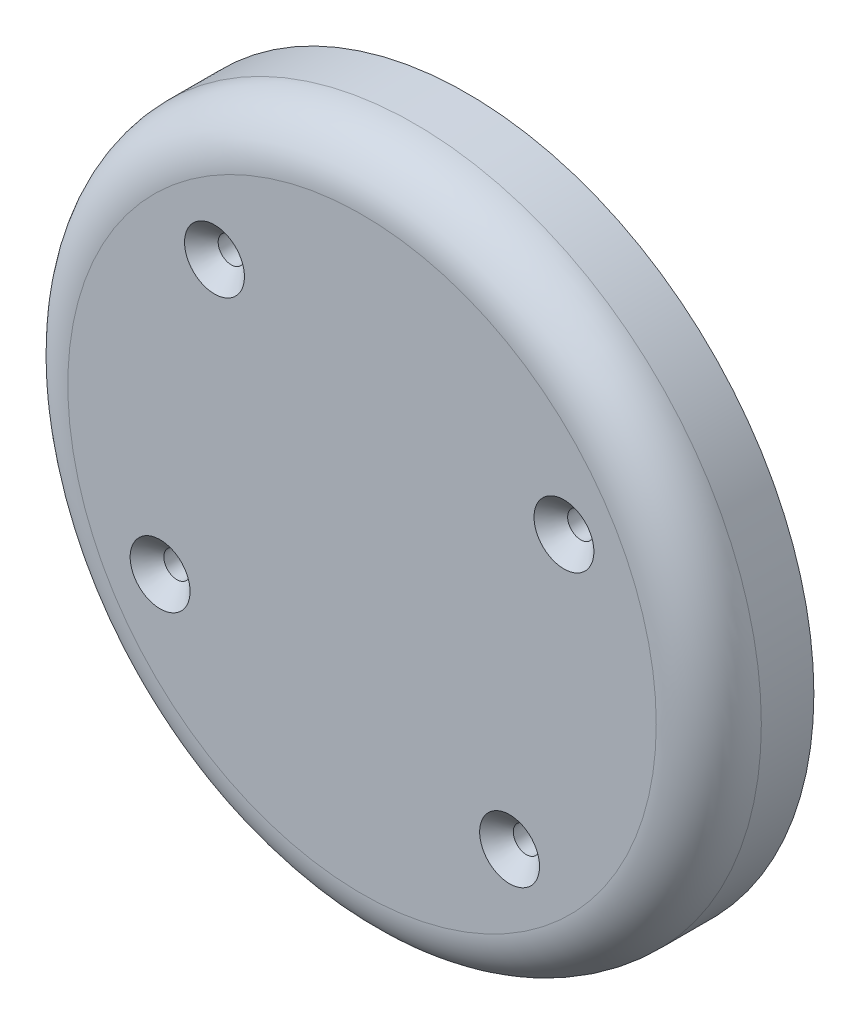
from build123d import *

# Parameters (mm, degrees)
CROQUIS1_R              = 33
SALIENTE_EXTRUIR1_DEPTH = 10
VACIADO1_T              = -3
REDONDEO1_R             = 5
CORTAR_EXTRUIR1_REACH   = 49.728
CROQUIS2_R              = 1.25
CHAFL_N1_SIZE           = 1.6


with BuildPart() as part:
    # Croquis1 → Saliente-Extruir1 (new body)
    with BuildSketch(Plane.XY):
        Circle(CROQUIS1_R)
    extrude(amount=SALIENTE_EXTRUIR1_DEPTH)

    # Vaciado1
    vaciado1_openings = [part.faces().sort_by_distance(p)[0] for p in [
        (0, 0, 0),
    ]]
    offset(amount=VACIADO1_T, openings=vaciado1_openings, kind=Kind.INTERSECTION)

    # Redondeo1
    redondeo1_edges = [part.edges().sort_by_distance(p)[0] for p in [
        (-33, 0, 10),
        (-30, 0, 7),
    ]]
    fillet(redondeo1_edges, radius=REDONDEO1_R)

    # Croquis2 → Cortar-Extruir1 (cut, up to next)
    with BuildSketch(Plane.XY.offset(10), mode=Mode.PRIVATE) as cortar_extruir1_sk1:
        with Locations((14.041823927, -17.282568698)):
            Circle(CROQUIS2_R)
    cortar_extruir1_tool1 = extrude(cortar_extruir1_sk1.sketch, amount=-CORTAR_EXTRUIR1_REACH, mode=Mode.PRIVATE) & part.part
    # Croquis2 → Cortar-Extruir1 (cut, up to next)
    with BuildSketch(Plane.XY.offset(10), mode=Mode.PRIVATE) as cortar_extruir1_sk2:
        with Locations((19.215864901, 11.252134735)):
            Circle(CROQUIS2_R)
    cortar_extruir1_tool2 = extrude(cortar_extruir1_sk2.sketch, amount=-CORTAR_EXTRUIR1_REACH, mode=Mode.PRIVATE) & part.part
    # Croquis2 → Cortar-Extruir1 (cut, up to next)
    with BuildSketch(Plane.XY.offset(10), mode=Mode.PRIVATE) as cortar_extruir1_sk3:
        with Locations((-19.215864901, -11.252134735)):
            Circle(CROQUIS2_R)
    cortar_extruir1_tool3 = extrude(cortar_extruir1_sk3.sketch, amount=-CORTAR_EXTRUIR1_REACH, mode=Mode.PRIVATE) & part.part
    # Croquis2 → Cortar-Extruir1 (cut, up to next)
    with BuildSketch(Plane.XY.offset(10), mode=Mode.PRIVATE) as cortar_extruir1_sk4:
        with Locations((-14.041823927, 17.282568698)):
            Circle(CROQUIS2_R)
    cortar_extruir1_tool4 = extrude(cortar_extruir1_sk4.sketch, amount=-CORTAR_EXTRUIR1_REACH, mode=Mode.PRIVATE) & part.part
    add(cortar_extruir1_tool1.solids().sort_by_distance((14.041824, -17.282569, 10))[0], mode=Mode.SUBTRACT)
    add(cortar_extruir1_tool2.solids().sort_by_distance((19.215865, 11.252135, 10))[0], mode=Mode.SUBTRACT)
    add(cortar_extruir1_tool3.solids().sort_by_distance((-19.215865, -11.252135, 10))[0], mode=Mode.SUBTRACT)
    add(cortar_extruir1_tool4.solids().sort_by_distance((-14.041824, 17.282569, 10))[0], mode=Mode.SUBTRACT)

    # Chaflán1
    chafl_n1_edges = [part.edges().sort_by_distance(p)[0] for p in [
        (12.791823927, -17.282568698, 10),
        (17.965864901, 11.252134735, 10),
        (-20.465864901, -11.252134735, 10),
        (-15.291823927, 17.282568698, 10),
    ]]
    chamfer(chafl_n1_edges, length=CHAFL_N1_SIZE)


solid = part.part
